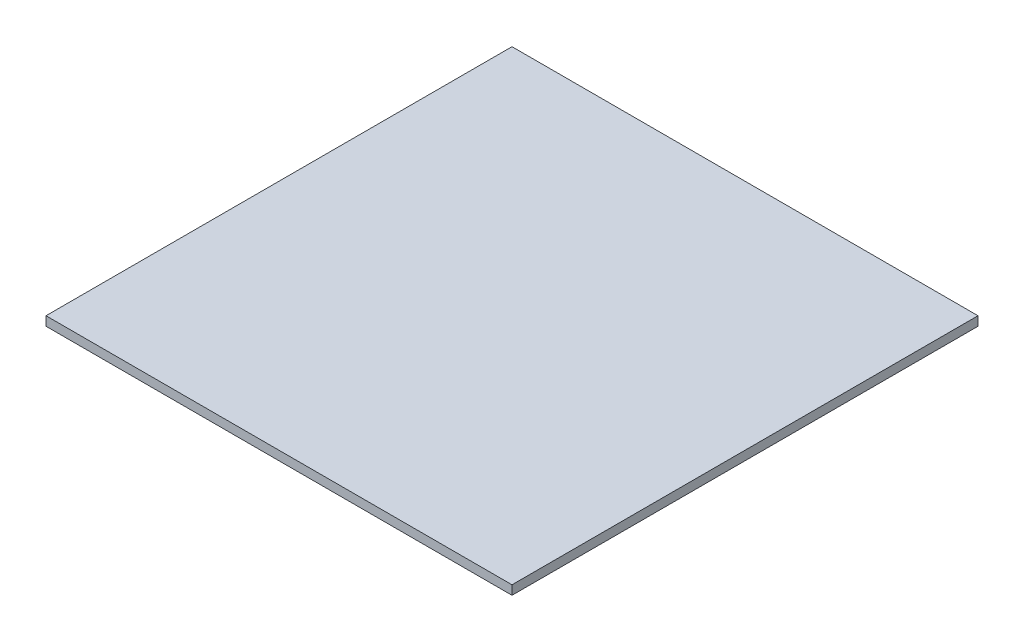
from build123d import *

# Parameters (mm, degrees)
SKETCH1_W           = 510
SKETCH1_H           = 510
BOSS_EXTRUDE1_DEPTH = 10


with BuildPart() as part:
    # Sketch1 → Boss-Extrude1 (new body)
    with BuildSketch(Plane(origin=(0, 0, 0), x_dir=(1, 0, 0), z_dir=(0, 1, 0))):
        with Locations((255, -255)):
            Rectangle(SKETCH1_W, SKETCH1_H)
    extrude(amount=BOSS_EXTRUDE1_DEPTH)


solid = part.part
